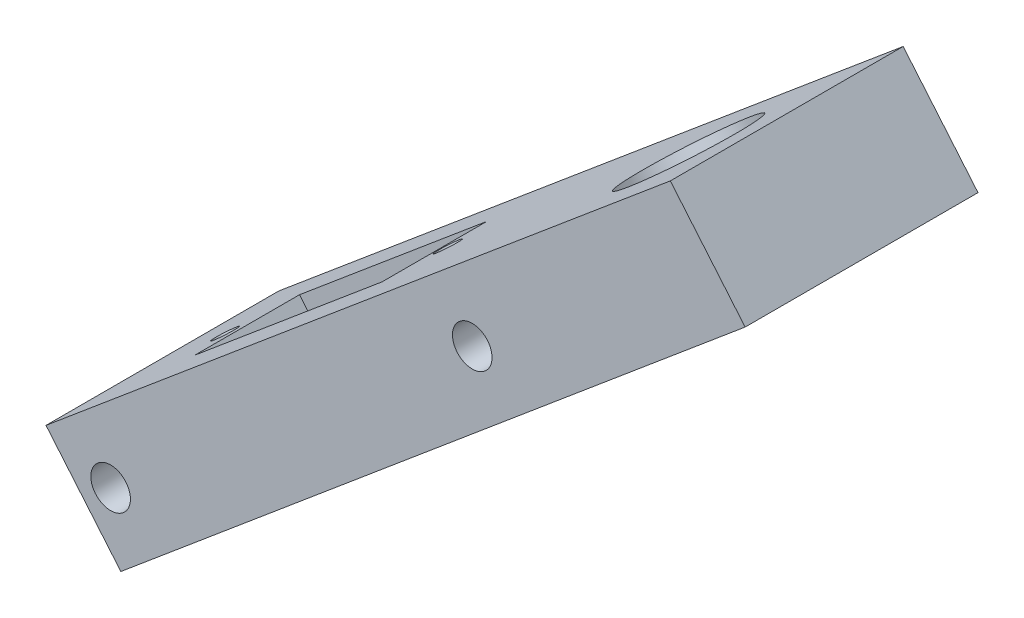
from build123d import *

# Parameters (mm, degrees)
SKETCH_1_W          = 70
SKETCH_1_H          = 20
SKETCH_1_W_2        = 21
SKETCH_1_H_2        = 9
EXTRUDE_1_DEPTH     = 10
CUT_EXTRUDE_1_REACH = 57.98
SKETCH_3_R          = 5.2
SKETCH_3_R_2        = 1
CUT_EXTRUDE_2_REACH = 60.746
SKETCH_4_R          = 1.7


with BuildPart() as part:
    # 草图1 → 凸台-拉伸1 (new body)
    with BuildSketch(Plane(origin=(0, 0, 0), x_dir=(0.7660444431189771, 0.6427876096865406, 0), z_dir=(-0.6427876096865406, 0.7660444431189771, 0))):
        with Locations((15, 0)):
            Rectangle(SKETCH_1_W, SKETCH_1_H)
        Rectangle(SKETCH_1_W_2, SKETCH_1_H_2, mode=Mode.SUBTRACT)
    extrude(amount=EXTRUDE_1_DEPTH)

    # 草图3 → 切除-拉伸1 (cut, up to next)
    with BuildSketch(Plane(origin=(-6.427876097, 7.660444431, 0), x_dir=(0.7660444431189771, 0.6427876096865406, 0), z_dir=(-0.6427876096865405, 0.766044443118977, 0)), mode=Mode.PRIVATE) as cut_extrude_1_sk1:
        with Locations((39, 0)):
            Circle(SKETCH_3_R)
    cut_extrude_1_tool1 = extrude(cut_extrude_1_sk1.sketch, amount=-CUT_EXTRUDE_1_REACH, mode=Mode.PRIVATE) & part.part
    # 草图3 → 切除-拉伸1 (cut, up to next)
    with BuildSketch(Plane(origin=(-6.427876097, 7.660444431, 0), x_dir=(0.7660444431189771, 0.6427876096865406, 0), z_dir=(-0.6427876096865405, 0.766044443118977, 0)), mode=Mode.PRIVATE) as cut_extrude_1_sk2:
        with Locations((-13, 0)):
            Circle(SKETCH_3_R_2)
    cut_extrude_1_tool2 = extrude(cut_extrude_1_sk2.sketch, amount=-CUT_EXTRUDE_1_REACH, mode=Mode.PRIVATE) & part.part
    # 草图3 → 切除-拉伸1 (cut, up to next)
    with BuildSketch(Plane(origin=(-6.427876097, 7.660444431, 0), x_dir=(0.7660444431189771, 0.6427876096865406, 0), z_dir=(-0.6427876096865405, 0.766044443118977, 0)), mode=Mode.PRIVATE) as cut_extrude_1_sk3:
        with Locations((12, 0)):
            Circle(SKETCH_3_R_2)
    cut_extrude_1_tool3 = extrude(cut_extrude_1_sk3.sketch, amount=-CUT_EXTRUDE_1_REACH, mode=Mode.PRIVATE) & part.part
    add(cut_extrude_1_tool1.solids().sort_by_distance((23.447857, 32.729161, 0))[0], mode=Mode.SUBTRACT)
    add(cut_extrude_1_tool2.solids().sort_by_distance((-16.386454, -0.695794, 0))[0], mode=Mode.SUBTRACT)
    add(cut_extrude_1_tool3.solids().sort_by_distance((2.764657, 15.373896, 0))[0], mode=Mode.SUBTRACT)

    # 草图4 → 切除-拉伸2 (cut, up to next)
    with BuildSketch(Plane.XY.offset(10), mode=Mode.PRIVATE) as cut_extrude_2_sk1:
        with Locations((-16.198218668, -7.064882864)):
            Circle(SKETCH_4_R)
    cut_extrude_2_tool1 = extrude(cut_extrude_2_sk1.sketch, amount=-CUT_EXTRUDE_2_REACH, mode=Mode.PRIVATE) & part.part
    # 草图4 → 切除-拉伸2 (cut, up to next)
    with BuildSketch(Plane.XY.offset(10), mode=Mode.PRIVATE) as cut_extrude_2_sk2:
        with Locations((14.862649296, 18.998279989)):
            Circle(SKETCH_4_R)
    cut_extrude_2_tool2 = extrude(cut_extrude_2_sk2.sketch, amount=-CUT_EXTRUDE_2_REACH, mode=Mode.PRIVATE) & part.part
    add(cut_extrude_2_tool1.solids().sort_by_distance((-16.198219, -7.064883, 10))[0], mode=Mode.SUBTRACT)
    add(cut_extrude_2_tool2.solids().sort_by_distance((14.862649, 18.99828, 10))[0], mode=Mode.SUBTRACT)


solid = part.part
